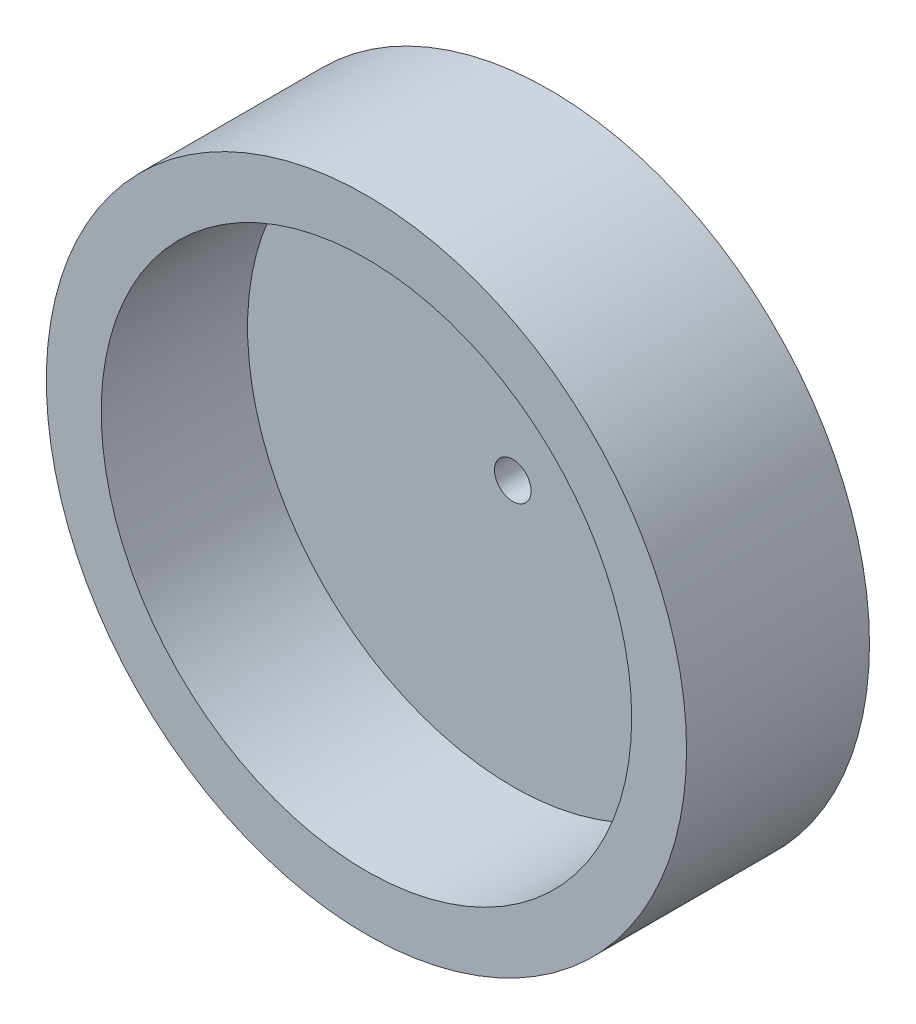
from build123d import *

# Parameters (mm, degrees)
SKETCH1_R           = 17.5
BOSS_EXTRUDE1_DEPTH = 2
SKETCH2_R           = 17.5
SKETCH2_R_2         = 14.5
BOSS_EXTRUDE2_DEPTH = 8
SKETCH3_R           = 1
CUT_EXTRUDE1_DEPTH  = 27.009613607


with BuildPart() as part:
    # Sketch1 → Boss-Extrude1 (new body)
    with BuildSketch(Plane.XY):
        Circle(SKETCH1_R)
    extrude(amount=BOSS_EXTRUDE1_DEPTH)

    # Sketch2 → Boss-Extrude2 (add)
    with BuildSketch(Plane.XY.offset(2)):
        Circle(SKETCH2_R)
        Circle(SKETCH2_R_2, mode=Mode.SUBTRACT)
    extrude(amount=BOSS_EXTRUDE2_DEPTH)

    # Sketch3 → Cut-Extrude1 (cut, through all)
    with BuildSketch(Plane.XY.offset(2)):
        Circle(SKETCH3_R)
    extrude(amount=-CUT_EXTRUDE1_DEPTH, mode=Mode.SUBTRACT)


solid = part.part
